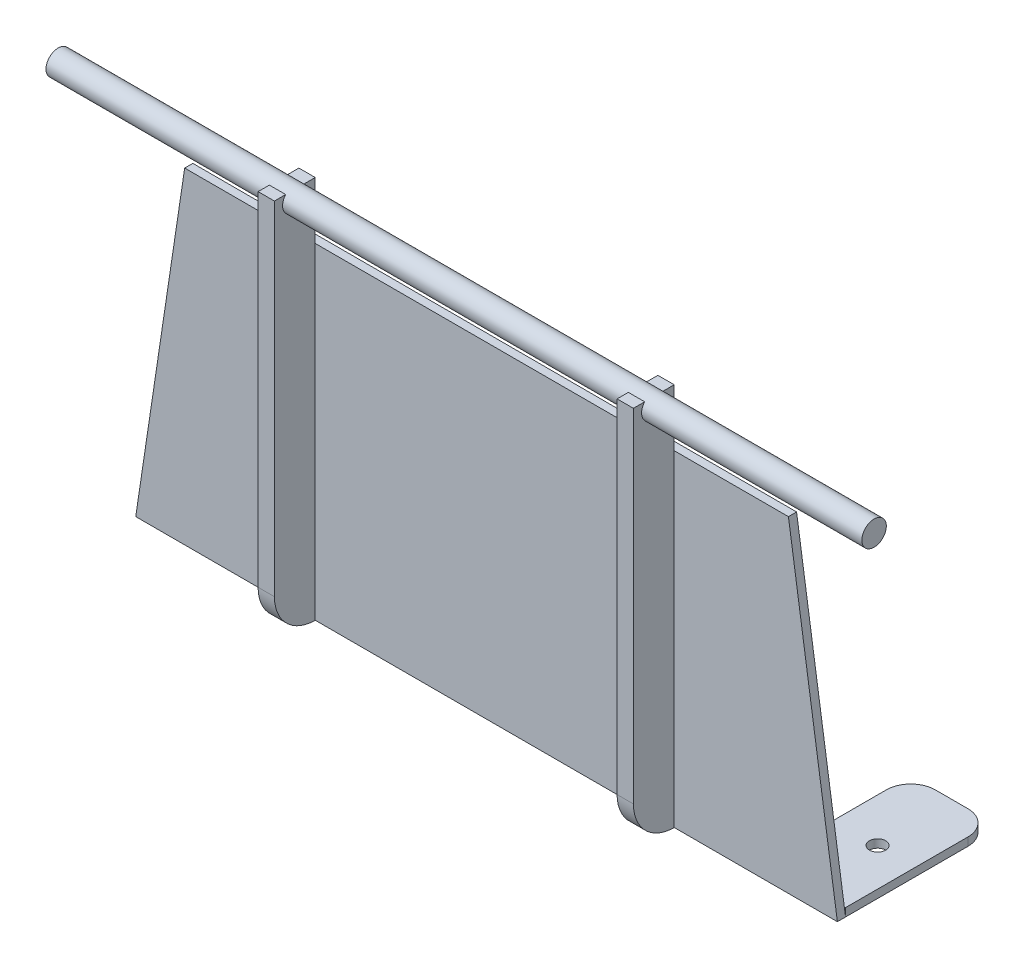
from build123d import *

# Parameters (mm, degrees)
BOSS_EXTRUDE2_DEPTH  = 1
SKETCH2_W            = 5
SKETCH2_H            = 47
BOSS_EXTRUDE3_DEPTH  = 2
FILLET2_R            = 5
FILLET2_OF_MIRROR2_R = 5
SKETCH3_R            = 1.5
BOSS_EXTRUDE5_DEPTH  = 100
SKETCH5_W            = 10
SKETCH5_H            = 18
BOSS_EXTRUDE6_DEPTH  = 1
FILLET3_R            = 3
SKETCH6_R            = 1
CUT_EXTRUDE1_DEPTH   = 1
FILLET3_OF_MIRROR4_R = 3


with BuildPart() as part:
    # Sketch1 → Boss-Extrude2 (new body)
    with BuildSketch(Plane.XY):
        Polygon((-43, 0), (43, 0), (37, 40), (-37, 40), align=None)
    extrude(amount=BOSS_EXTRUDE2_DEPTH)

    # Sketch2 → Boss-Extrude3 (add)
    with BuildSketch(Plane(origin=(21, 0, 0), x_dir=(0, 0, -1), z_dir=(1, 0, 0))):
        with Locations((-3.5, 23.5)):
            Rectangle(SKETCH2_W, SKETCH2_H)
    boss_extrude3 = extrude(amount=BOSS_EXTRUDE3_DEPTH)

    # Fillet2
    fillet2_edges = [part.edges().sort_by_distance(p)[0] for p in [
        (22, 0, 6),
    ]]
    fillet(fillet2_edges, radius=FILLET2_R)

    # Mirror2: Boss-Extrude3 across plane
    add(boss_extrude3.mirror(Plane(origin=(0, 0, 0), x_dir=(0, 0, 1), z_dir=(1, 0, 0))))

    # Fillet2 of Mirror2
    fillet2_of_mirror2_edges = [part.edges().sort_by_distance(p)[0] for p in [
        (-22, 0, 6),
    ]]
    fillet(fillet2_of_mirror2_edges, radius=FILLET2_OF_MIRROR2_R)

    # Sketch3 → Boss-Extrude5 (add)
    with BuildSketch(Plane(origin=(50, 0, 0), x_dir=(0, 0, -1), z_dir=(1, 0, 0))):
        with Locations((-3.5, 46)):
            Circle(SKETCH3_R)
    extrude(amount=-BOSS_EXTRUDE5_DEPTH)

    # Sketch5 → Boss-Extrude6 (add)
    with BuildSketch(Plane(origin=(0, 0, 0), x_dir=(1, 0, 0), z_dir=(0, 1, 0))):
        with Locations((-38, 9)):
            Rectangle(SKETCH5_W, SKETCH5_H)
    boss_extrude6 = extrude(amount=BOSS_EXTRUDE6_DEPTH)

    # Fillet3
    fillet3_edges = [part.edges().sort_by_distance(p)[0] for p in [
        (-33, 0.5, -18),
        (-43, 0.5, -18),
    ]]
    fillet(fillet3_edges, radius=FILLET3_R)

    # Sketch6 → Cut-Extrude1 (cut)
    with BuildSketch(Plane(origin=(0, 1, 0), x_dir=(1, 0, 0), z_dir=(0, 1, 0))):
        with Locations(Location((-38.364339828, 8.560660172, 0), (0, 0, 270))):
            Circle(SKETCH6_R)
    cut_extrude1 = extrude(amount=-CUT_EXTRUDE1_DEPTH, mode=Mode.SUBTRACT)

    # Mirror4: Boss-Extrude6, Cut-Extrude1 across plane
    add(boss_extrude6.mirror(Plane(origin=(0, 0, 0), x_dir=(0, 0, 1), z_dir=(1, 0, 0))))
    add(cut_extrude1.mirror(Plane(origin=(0, 0, 0), x_dir=(0, 0, 1), z_dir=(1, 0, 0))), mode=Mode.SUBTRACT)

    # Fillet3 of Mirror4
    fillet3_of_mirror4_edges = [part.edges().sort_by_distance(p)[0] for p in [
        (33, 0.5, -18),
        (43, 0.5, -18),
    ]]
    fillet(fillet3_of_mirror4_edges, radius=FILLET3_OF_MIRROR4_R)


solid = part.part
